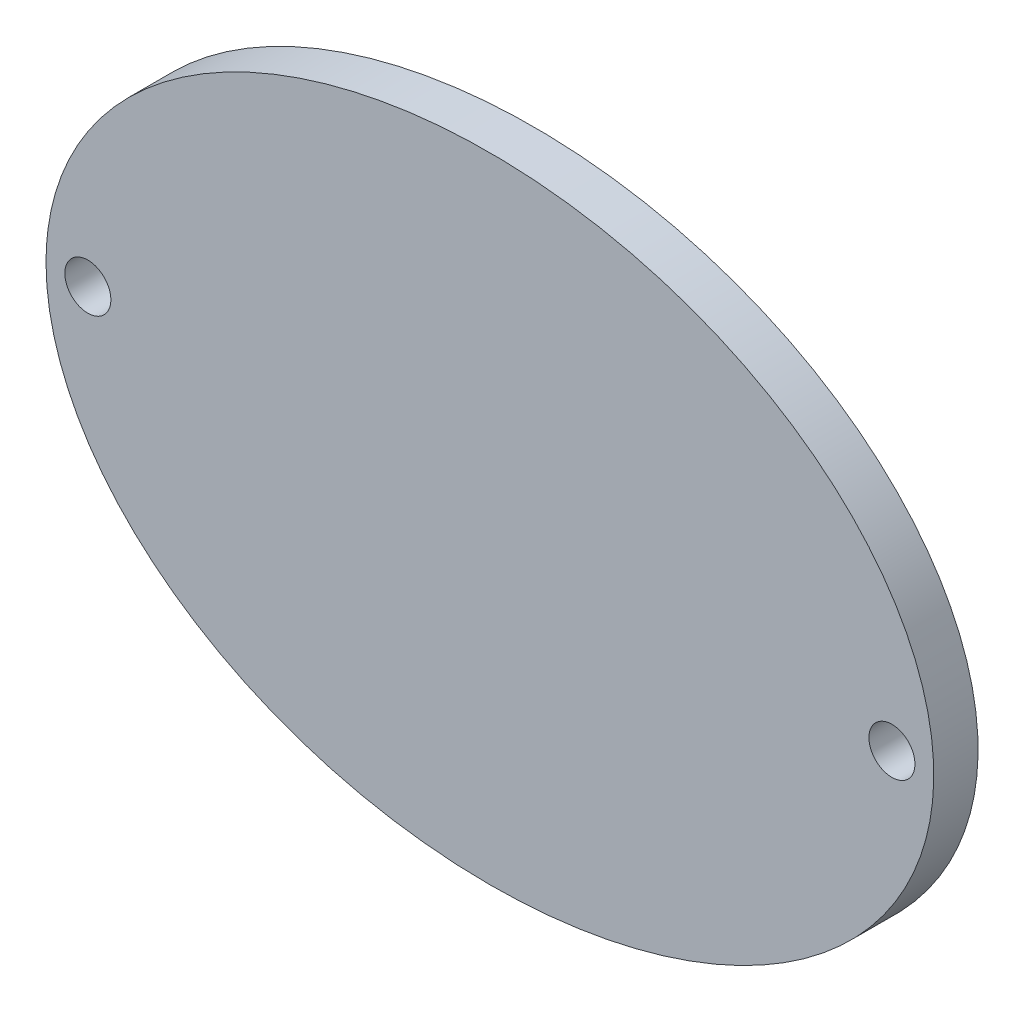
from build123d import *

# Parameters (mm, degrees)
SKETCH1_RX          = 31.82
SKETCH1_RY          = 22.725
BOSS_EXTRUDE1_DEPTH = 3.175
SKETCH2_R           = 1.65
CUT_EXTRUDE1_DEPTH  = 40.230328191


with BuildPart() as part:
    # Sketch1 → Boss-Extrude1 (new body)
    with BuildSketch(Plane.XY):
        with Locations(Location((0, 0), (0, 0, 180))):
            Ellipse(SKETCH1_RX, SKETCH1_RY)
    extrude(amount=BOSS_EXTRUDE1_DEPTH)

    # Sketch2 → Cut-Extrude1 (cut, through all)
    with BuildSketch(Plane.XY.offset(3.175)):
        with Locations((-28.8198, 0)):
            Circle(SKETCH2_R)
        with Locations(Location((28.8198, 0, 0), (0, 0, 180))):
            Circle(SKETCH2_R)
    extrude(amount=-CUT_EXTRUDE1_DEPTH, mode=Mode.SUBTRACT)


solid = part.part
